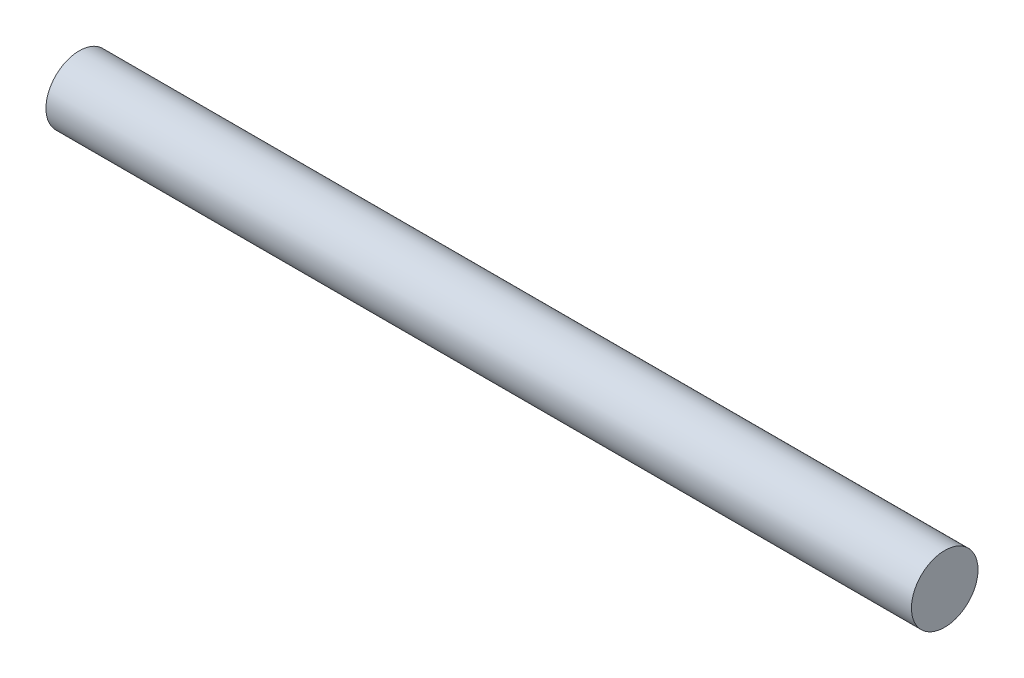
from build123d import *

# Parameters (mm, degrees)
BASES_R    = 1.5
BASE_DEPTH = 19.5


with BuildPart() as part:
    # BaseS → Base (new, symmetric)
    with BuildSketch(Plane(origin=(0, 0, 0), x_dir=(0, 0, -1), z_dir=(1, 0, 0))):
        Circle(BASES_R)
    extrude(amount=BASE_DEPTH, both=True)


solid = part.part
